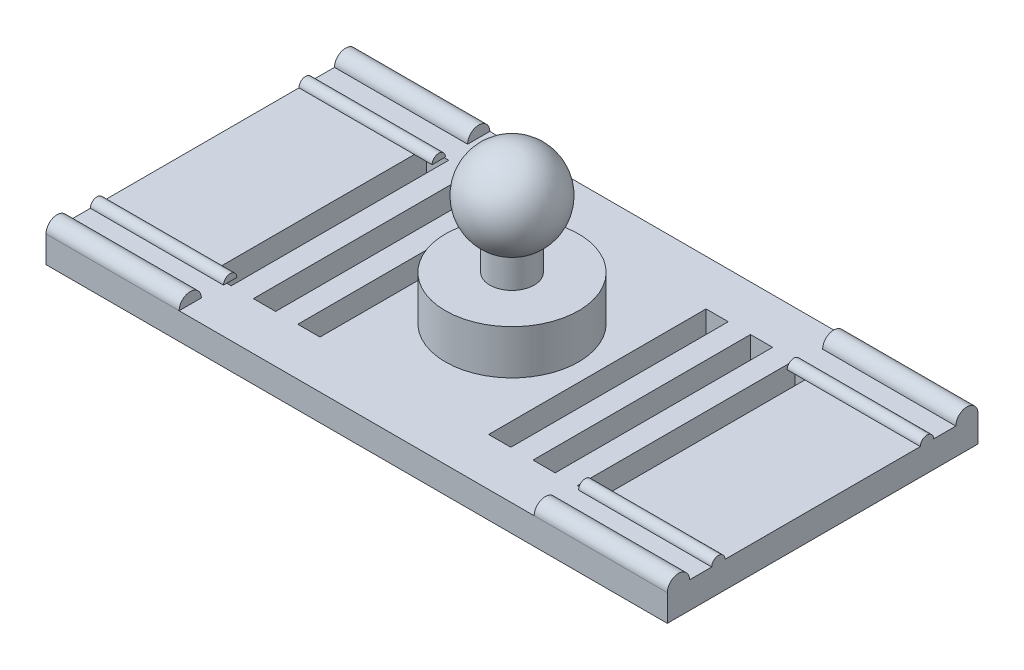
from build123d import *

# Parameters (mm, degrees)
SKETCH_1_W          = 140
SKETCH_1_H          = 70
EXTRUDE_1_DEPTH     = 6
SKETCH_2_R          = 15
EXTRUDE_2_DEPTH     = 10
SKETCH_5_R          = 5
EXTRUDE_4_DEPTH     = 15
SKETCH_7_W          = 5
SKETCH_7_H          = 49
CUT_EXTRUDE_1_DEPTH = 6
EXTRUDE_5_DEPTH     = 30
EXTRUDE_START       = -30
EXTRUDE_6_DEPTH     = 30


with BuildPart() as part:
    # 草图1 → 凸台-拉伸1 (new body)
    with BuildSketch(Plane(origin=(0, 0, 0), x_dir=(1, 0, 0), z_dir=(0, 1, 0))):
        with Locations((3.730042991, 0.147818203)):
            Rectangle(SKETCH_1_W, SKETCH_1_H)
    extrude(amount=EXTRUDE_1_DEPTH)

    # 草图2 → 凸台-拉伸2 (add)
    with BuildSketch(Plane(origin=(0, 6, 0), x_dir=(1, 0, 0), z_dir=(0, 1, 0))):
        with Locations(Location((3.730042991, 0.147818203, 0), (0, 0, 270))):
            Circle(SKETCH_2_R)
    extrude(amount=EXTRUDE_2_DEPTH)

    # 草图5 → 凸台-拉伸4 (add)
    with BuildSketch(Plane(origin=(0, 16, 0), x_dir=(1, 0, 0), z_dir=(0, 1, 0))):
        with Locations(Location((3.730042991, 0.147818203, 0), (0, 0, 270))):
            Circle(SKETCH_5_R)
    extrude(amount=EXTRUDE_4_DEPTH)

    # 草图6 → 旋转2 (revolve)
    with BuildSketch(Plane(origin=(0, 31, 0), x_dir=(1, 0, 0), z_dir=(0, 1, 0))):
        with BuildLine():
            Line((3.730042991, 10.047818203), (3.730042991, -9.752181797))
            ThreePointArc((3.730042991, -9.752181797), (13.630042991, 0.147818203), (3.730042991, 10.047818203))
        make_face()
    revolve(axis=Axis((3.730042991, 31, -10.047818203), (0, 0, 1)))

    # 草图7 → 切除-拉伸1 (cut)
    with BuildSketch(Plane.XZ):
        with Locations((25.230042991, -0.380891395)):
            Rectangle(SKETCH_7_W, SKETCH_7_H)
        with Locations((-37.769957009, -0.380891395)):
            Rectangle(SKETCH_7_W, SKETCH_7_H)
        with Locations((35.230042991, -0.380891395)):
            Rectangle(SKETCH_7_W, SKETCH_7_H)
        with Locations((45.230042991, -0.380891395)):
            Rectangle(SKETCH_7_W, SKETCH_7_H)
        with Locations((-27.769957009, -0.380891395)):
            Rectangle(SKETCH_7_W, SKETCH_7_H)
        with Locations((-17.769957009, -0.380891395)):
            Rectangle(SKETCH_7_W, SKETCH_7_H)
    extrude(amount=-CUT_EXTRUDE_1_DEPTH, mode=Mode.SUBTRACT)

    # 草图9 → 凸台-拉伸5 (add)
    with BuildSketch(Plane.ZY.offset(66.269957009)):
        with BuildLine():
            Line((29.852181797, 6), (34.852181797, 6))
            ThreePointArc((34.852181797, 6), (32.352181797, 8.5), (29.852181797, 6))
        make_face()
        with BuildLine():
            Line((-35.147818203, 6), (-30.147818203, 6))
            ThreePointArc((-30.147818203, 6), (-32.647818203, 8.5), (-35.147818203, 6))
        make_face()
        with BuildLine():
            Line((21.852181797, 6), (24.852181797, 6))
            ThreePointArc((24.852181797, 6), (23.352181797, 7.5), (21.852181797, 6))
        make_face()
        with BuildLine():
            Line((-25.147818203, 6), (-22.147818203, 6))
            ThreePointArc((-22.147818203, 6), (-23.647818203, 7.5), (-25.147818203, 6))
        make_face()
    extrude(amount=-EXTRUDE_5_DEPTH)

    # 草图11 → 凸台-拉伸6 (add)
    with BuildSketch(Plane(origin=(73.730042991, 0, 0), x_dir=(0, 0, -1), z_dir=(1, 0, 0)).offset(EXTRUDE_START)):
        with BuildLine():
            Line((30.147818203, 6), (35.147818203, 6))
            ThreePointArc((35.147818203, 6), (32.647818203, 8.5), (30.147818203, 6))
        make_face()
        with BuildLine():
            Line((-34.852181797, 6), (-29.852181797, 6))
            ThreePointArc((-29.852181797, 6), (-32.352181797, 8.5), (-34.852181797, 6))
        make_face()
        with BuildLine():
            Line((22.147818203, 6), (25.147818203, 6))
            ThreePointArc((25.147818203, 6), (23.647818203, 7.5), (22.147818203, 6))
        make_face()
        with BuildLine():
            Line((-24.852181797, 6), (-21.852181797, 6))
            ThreePointArc((-21.852181797, 6), (-23.352181797, 7.5), (-24.852181797, 6))
        make_face()
    extrude(amount=EXTRUDE_6_DEPTH)


solid = part.part
